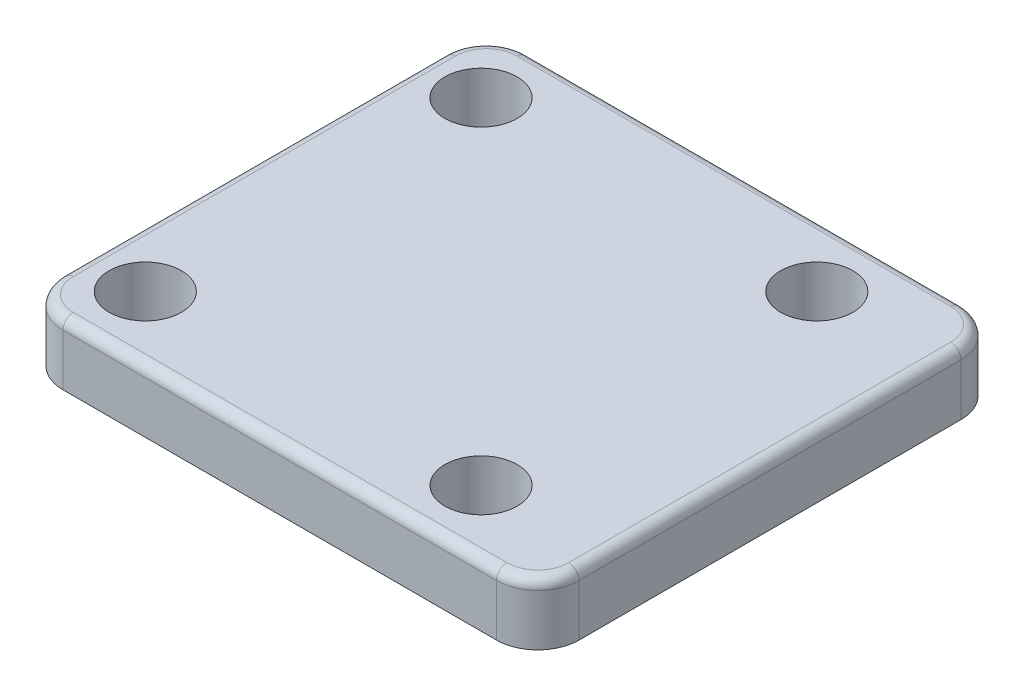
from build123d import *

# Parameters (mm, degrees)
BOSS_EXTRUDE1_DEPTH = 6
FILLET1_R           = 1
SKETCH2_R           = 16
BOSS_EXTRUDE6_DEPTH = 8
CHAMFER3_SIZE       = 1
SKETCH3_R           = 3.5
CUT_EXTRUDE1_DEPTH  = 37.80013593


with BuildPart() as part:
    # Sketch1 → Boss-Extrude1 (new body)
    with BuildSketch(Plane(origin=(0, 0, 0), x_dir=(1, 0, 0), z_dir=(0, 1, 0))):
        with BuildLine():
            Line((24, -22.5), (-18, -22.5))
            ThreePointArc((-18, -22.5), (-20.828427125, -21.328427125), (-22, -18.5))
            Line((-22, -18.5), (-22, 18.5))
            ThreePointArc((-22, 18.5), (-20.828427125, 21.328427125), (-18, 22.5))
            Line((-18, 22.5), (24, 22.5))
            ThreePointArc((24, 22.5), (26.828427125, 21.328427125), (28, 18.5))
            Line((28, 18.5), (28, -18.5))
            ThreePointArc((28, -18.5), (26.828427125, -21.328427125), (24, -22.5))
        make_face()
    extrude(amount=BOSS_EXTRUDE1_DEPTH)

    # Fillet1
    fillet1_edges = [part.edges().sort_by_distance(p)[0] for p in [
        (26.828427125, 6, -21.328427125),
        (3, 6, -22.5),
        (-20.828427125, 6, -21.328427125),
        (-22, 6, 0),
        (-20.828427125, 6, 21.328427125),
        (3, 6, 22.5),
        (26.828427125, 6, 21.328427125),
        (28, 6, 0),
    ]]
    fillet(fillet1_edges, radius=FILLET1_R)

    # Sketch2 → Boss-Extrude6 (add)
    with BuildSketch(Plane(origin=(0, 6, 0), x_dir=(1, 0, 0), z_dir=(0, 1, 0))):
        with Locations(Location((0, 0, 0), (0, 0, 270))):
            Circle(SKETCH2_R)
    extrude(amount=-BOSS_EXTRUDE6_DEPTH)

    # Chamfer3
    chamfer3_edges = [part.edges().sort_by_distance(p)[0] for p in [
        (0, -2, -16),
    ]]
    chamfer(chamfer3_edges, length=CHAMFER3_SIZE)

    # Sketch3 → Cut-Extrude1 (cut, through all)
    with BuildSketch(Plane(origin=(0, 6, 0), x_dir=(1, 0, 0), z_dir=(0, 1, 0))):
        with Locations(Location((-16.263455967, 16.263455967, 0), (0, 0, 270))):
            Circle(SKETCH3_R)
        with Locations(Location((16.263455967, 16.263455967, 0), (0, 0, 270))):
            Circle(SKETCH3_R)
        with Locations(Location((16.263455967, -16.263455967, 0), (0, 0, 270))):
            Circle(SKETCH3_R)
        with Locations(Location((-16.263455967, -16.263455967, 0), (0, 0, 270))):
            Circle(SKETCH3_R)
    extrude(amount=-CUT_EXTRUDE1_DEPTH, mode=Mode.SUBTRACT)


solid = part.part
